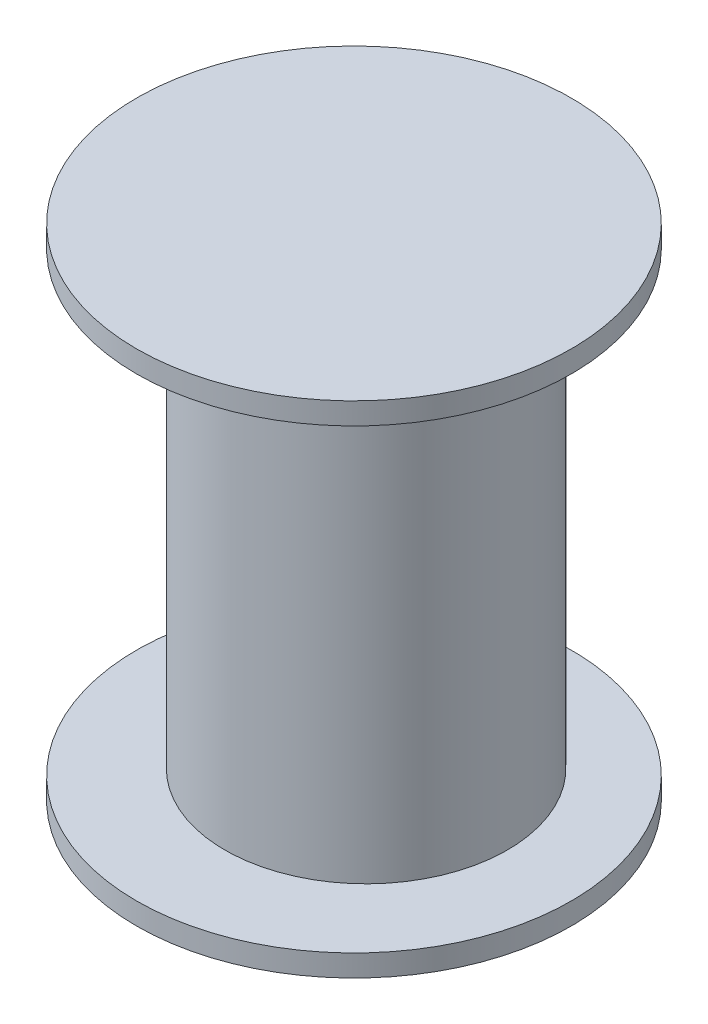
from build123d import *

# Parameters (mm, degrees)
CROQUIS1_R              = 10
SALIENTE_EXTRUIR1_DEPTH = 1
CROQUIS2_R              = 6.5
SALIENTE_EXTRUIR2_DEPTH = 21
CROQUIS3_R              = 10
SALIENTE_EXTRUIR3_DEPTH = 1


with BuildPart() as part:
    # Croquis1 → Saliente-Extruir1 (new body)
    with BuildSketch(Plane(origin=(0, 0, 0), x_dir=(1, 0, 0), z_dir=(0, 1, 0))):
        with Locations(Location((0, 0, 0), (0, 0, 270))):
            Circle(CROQUIS1_R)
    extrude(amount=SALIENTE_EXTRUIR1_DEPTH)

    # Croquis2 → Saliente-Extruir2 (add)
    with BuildSketch(Plane(origin=(0, 1, 0), x_dir=(1, 0, 0), z_dir=(0, 1, 0))):
        with Locations(Location((0, 0.559439901, 0), (0, 0, 90))):
            Circle(CROQUIS2_R)
    extrude(amount=SALIENTE_EXTRUIR2_DEPTH)

    # Croquis3 → Saliente-Extruir3 (add)
    with BuildSketch(Plane(origin=(0, 22, 0), x_dir=(1, 0, 0), z_dir=(0, 1, 0))):
        with Locations(Location((0, 0, 0), (0, 0, 270))):
            Circle(CROQUIS3_R)
    extrude(amount=SALIENTE_EXTRUIR3_DEPTH)


solid = part.part
